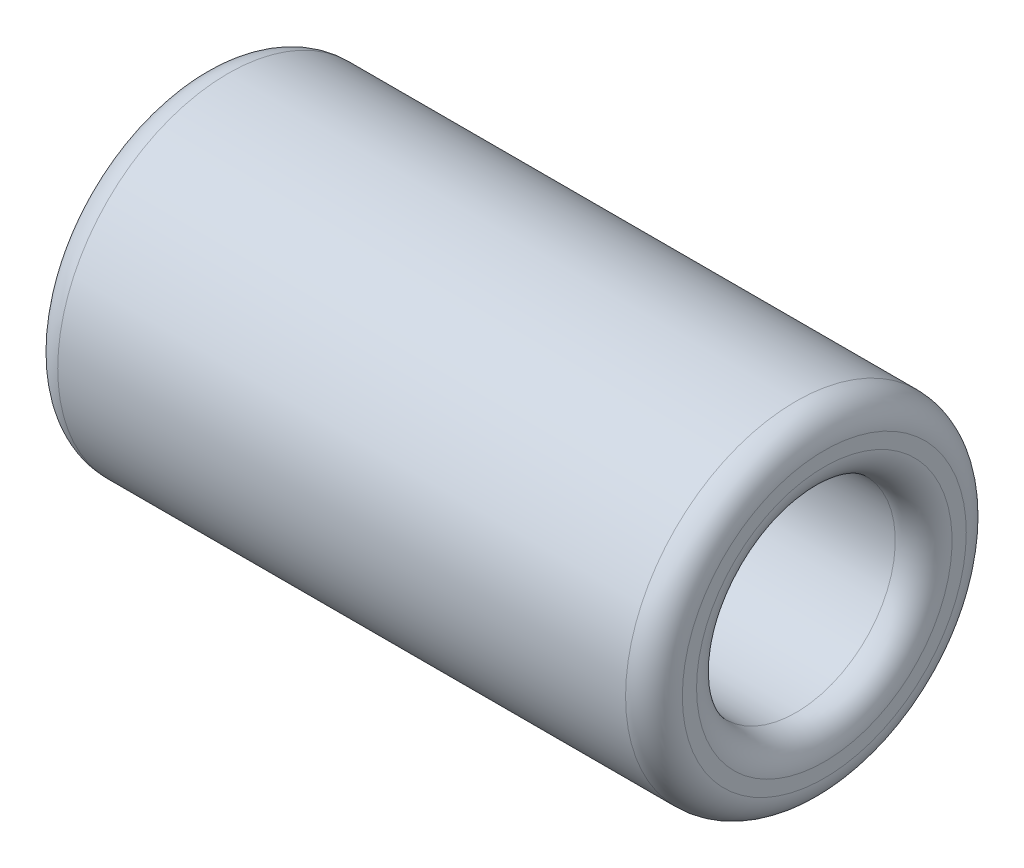
from build123d import *

# Parameters (mm, degrees)
FILLET1_R = 0.5


with BuildPart() as part:
    # Sketch1 → Revolve1 (revolve)
    with BuildSketch(Plane.XY, mode=Mode.PRIVATE) as revolve1_sk:
        Polygon((8, 1.9), (8.090129093, 1.75), (11, 1.75), (11, 3), (0, 3), (0, 1.9), align=None)
    revolve(revolve1_sk.sketch.rotate(Axis((0, 0, 0), (1, 0, 0)), 90), axis=Axis((0, 0, 0), (1, 0, 0)))

    # Fillet1
    fillet1_edges = [part.edges().sort_by_distance(p)[0] for p in [
        (0, 0, -3),
        (11, 0, -3),
        (11, 0, -1.75),
    ]]
    fillet(fillet1_edges, radius=FILLET1_R)


solid = part.part
